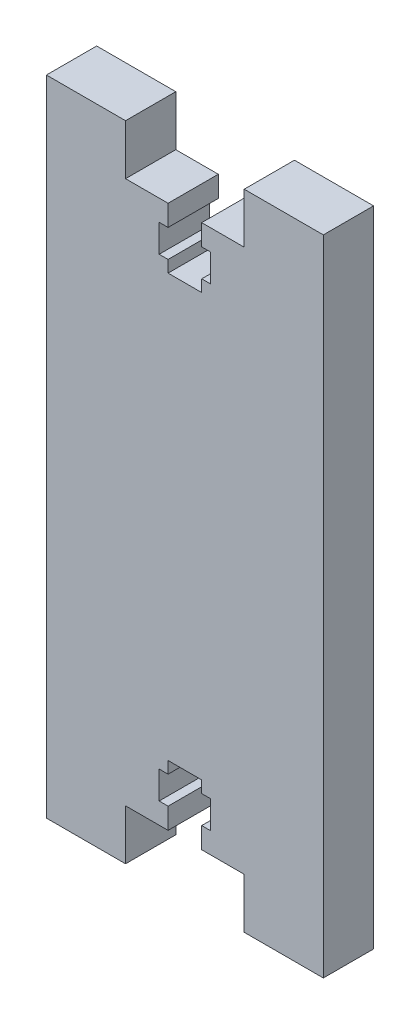
from build123d import *

# Parameters (mm, degrees)
SKETCH1_W           = 20
SKETCH1_H           = 12.7
BOSS_EXTRUDE1_DEPTH = 6.35


with BuildPart() as part:
    # Sketch1 → Boss-Extrude1 (new, symmetric)
    with BuildSketch(Plane.XY):
        Polygon((-35, 68.65), (-35, -68.65), (-15, -68.65), (-4.25, -68.65), (-4.25, -63.35), (-6.5, -63.35), (-6.5, -56.35), (-4.25, -56.35), (-4.25, -53.35), (4.25, -53.35), (4.25, -56.35), (6.5, -56.35), (6.5, -63.35), (4.25, -63.35), (4.25, -68.65), (15, -68.65), (35, -68.65), (35, 68.65), (15, 68.65), (4.25, 68.65), (4.25, 63.35), (6.5, 63.35), (6.5, 56.35), (4.25, 56.35), (4.25, 53.35), (-4.25, 53.35), (-4.25, 56.35), (-6.5, 56.35), (-6.5, 63.35), (-4.25, 63.35), (-4.25, 68.65), (-15, 68.65), align=None)
        with Locations((-25, -75)):
            Rectangle(SKETCH1_W, SKETCH1_H)
        with Locations((25, -75)):
            Rectangle(SKETCH1_W, SKETCH1_H)
        with Locations((25, 75)):
            Rectangle(SKETCH1_W, SKETCH1_H)
        with Locations((-25, 75)):
            Rectangle(SKETCH1_W, SKETCH1_H)
    extrude(amount=BOSS_EXTRUDE1_DEPTH, both=True)


solid = part.part
